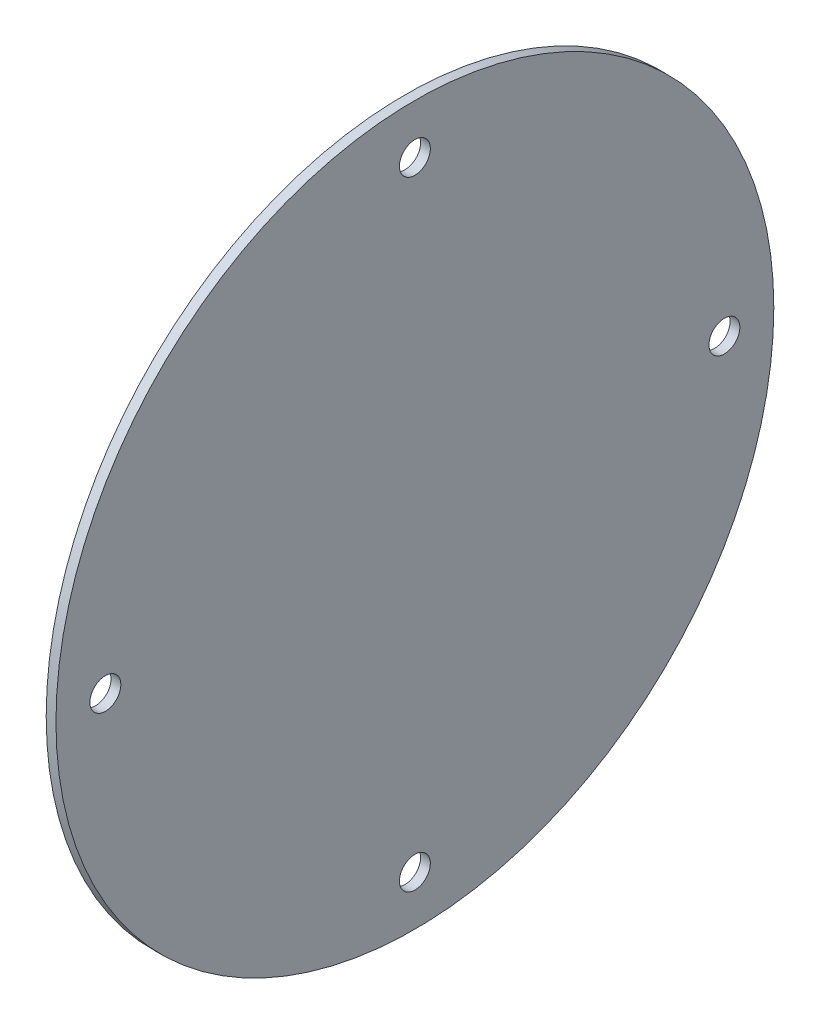
from build123d import *

# Parameters (mm, degrees)
SKETCH1_R           = 73.787
BOSS_EXTRUDE1_DEPTH = 2.0066
SKETCH2_R           = 3.175
CUT_EXTRUDE1_DEPTH  = 105.369867211
CIRPATTERN1_COUNT   = 4


with BuildPart() as part:
    # Sketch1 → Boss-Extrude1 (new body)
    with BuildSketch(Plane.YZ):
        with Locations(Location((0, 0, 0), (0, 0, 270))):
            Circle(SKETCH1_R)
    extrude(amount=BOSS_EXTRUDE1_DEPTH)

    # Sketch2 → Cut-Extrude1 (cut, through all)
    with BuildSketch(Plane(origin=(2.0066, 0, 0), x_dir=(0, 0, -1), z_dir=(1, 0, 0))):
        with Locations((-63.627, 0)):
            Circle(SKETCH2_R)
    cut_extrude1 = extrude(amount=-CUT_EXTRUDE1_DEPTH, mode=Mode.SUBTRACT)

    # CirPattern1: Cut-Extrude1 ×4 about axis
    cirpattern1_axis = Axis((0, 0, 0), (1, 0, 0))
    for i in range(1, CIRPATTERN1_COUNT):
        add(cut_extrude1.rotate(cirpattern1_axis, i * 360 / CIRPATTERN1_COUNT), mode=Mode.SUBTRACT)


solid = part.part
